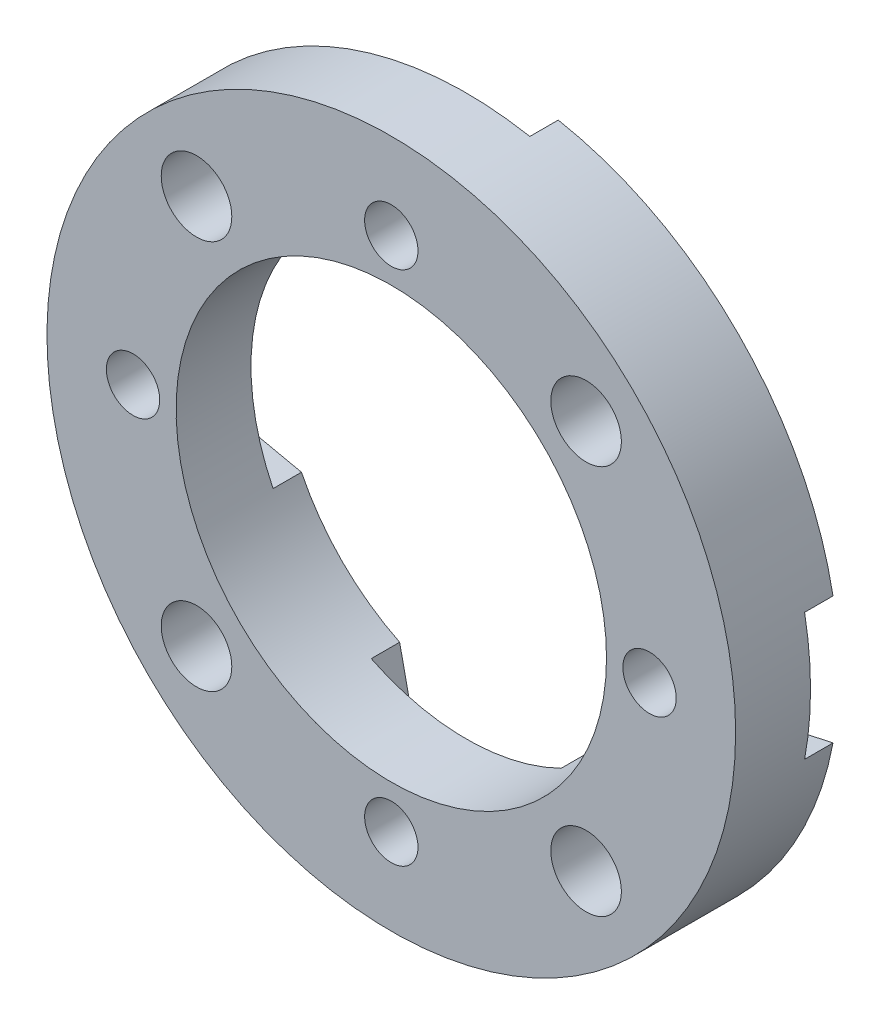
from build123d import *

# Parameters (mm, degrees)
SKETCH_1_R          = 20
SKETCH_1_R_2        = 1.55
SKETCH_1_R_3        = 2.05
EXTRUDE_1_DEPTH     = 6
SKETCH_2_R          = 12.5
CUT_EXTRUDE_1_DEPTH = 31
CUT_EXTRUDE_2_DEPTH = 1.65
CUT_EXTRUDE_3_DEPTH = 1.65


with BuildPart() as part:
    # 草图1 → 凸台-拉伸1 (new body)
    with BuildSketch(Plane.XY):
        Circle(SKETCH_1_R)
        with Locations((0, 15)):
            Circle(SKETCH_1_R_2, mode=Mode.SUBTRACT)
        with Locations((15, 0)):
            Circle(SKETCH_1_R_2, mode=Mode.SUBTRACT)
        with Locations((0, -15)):
            Circle(SKETCH_1_R_2, mode=Mode.SUBTRACT)
        with Locations((-15, 0)):
            Circle(SKETCH_1_R_2, mode=Mode.SUBTRACT)
        with Locations((-11.313708499, 11.313708499)):
            Circle(SKETCH_1_R_3, mode=Mode.SUBTRACT)
        with Locations((11.313708499, 11.313708499)):
            Circle(SKETCH_1_R_3, mode=Mode.SUBTRACT)
        with Locations((11.313708499, -11.313708499)):
            Circle(SKETCH_1_R_3, mode=Mode.SUBTRACT)
        with Locations((-11.313708499, -11.313708499)):
            Circle(SKETCH_1_R_3, mode=Mode.SUBTRACT)
    extrude(amount=EXTRUDE_1_DEPTH)

    # 草图2 → 切除-拉伸1 (cut)
    with BuildSketch(Plane(origin=(0, 0, 0), x_dir=(-1, 0, 0), z_dir=(0, 0, -1))):
        Circle(SKETCH_2_R)
    extrude(amount=-CUT_EXTRUDE_1_DEPTH, mode=Mode.SUBTRACT)

    # 草图4 → 切除-拉伸2 (cut)
    with BuildSketch(Plane(origin=(0, 0, 0), x_dir=(-1, 0, 0), z_dir=(0, 0, -1))):
        with BuildLine():
            Line((-3.697159098, 19.655304999), (-5.515511779, 11.217358415))
            ThreePointArc((-5.515511779, 11.217358415), (0, 12.5), (5.515511779, 11.217358415))
            Line((5.515511779, 11.217358415), (3.697159098, 19.655304999))
            ThreePointArc((3.697159098, 19.655304999), (0, 20), (-3.697159098, 19.655304999))
        make_face()
        with BuildLine():
            Line((19.655304999, -3.697159098), (11.217358415, -5.515511779))
            ThreePointArc((11.217358415, -5.515511779), (12.5, 0), (11.217358415, 5.515511779))
            Line((11.217358415, 5.515511779), (19.655304999, 3.697159098))
            ThreePointArc((19.655304999, 3.697159098), (20, 0), (19.655304999, -3.697159098))
        make_face()
        with BuildLine():
            Line((-3.697159098, -19.655304999), (-5.515511779, -11.217358415))
            ThreePointArc((-5.515511779, -11.217358415), (0, -12.5), (5.515511779, -11.217358415))
            Line((5.515511779, -11.217358415), (3.697159098, -19.655304999))
            ThreePointArc((3.697159098, -19.655304999), (0, -20), (-3.697159098, -19.655304999))
        make_face()
        with BuildLine():
            Line((-19.655304999, 3.697159098), (-11.217358415, 5.515511779))
            ThreePointArc((-11.217358415, 5.515511779), (-12.5, 0), (-11.217358415, -5.515511779))
            Line((-11.217358415, -5.515511779), (-19.655304999, -3.697159098))
            ThreePointArc((-19.655304999, -3.697159098), (-20, 0), (-19.655304999, 3.697159098))
        make_face()
    extrude(amount=-CUT_EXTRUDE_2_DEPTH, mode=Mode.SUBTRACT)

    # 草图5 → 切除-拉伸3 (cut)
    with BuildSketch(Plane(origin=(0, 0, 0), x_dir=(-1, 0, 0), z_dir=(0, 0, -1))):
        with BuildLine():
            Line((3.697159098, 19.655304999), (5.515511779, 11.217358415))
            ThreePointArc((5.515511779, 11.217358415), (8.838834765, 8.838834765), (11.217358415, 5.515511779))
            Line((11.217358415, 5.515511779), (19.655304999, 3.697159098))
            ThreePointArc((19.655304999, 3.697159098), (14.142135624, 14.142135624), (3.697159098, 19.655304999))
        make_face()
    extrude(amount=-CUT_EXTRUDE_3_DEPTH, mode=Mode.SUBTRACT)


solid = part.part
